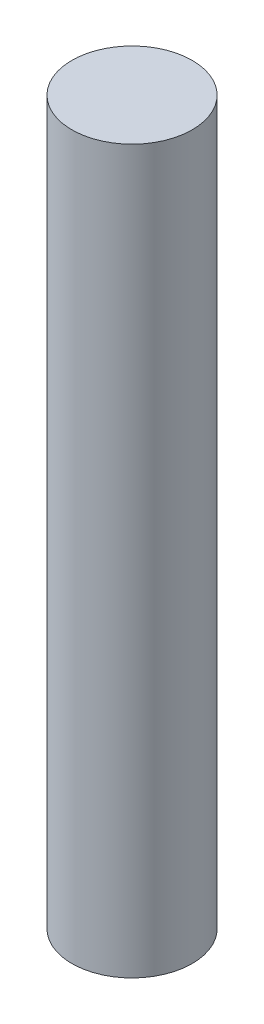
from build123d import *

# Parameters (mm, degrees)
SKETCH1_R           = 3.175
BOSS_EXTRUDE1_DEPTH = 38.1


with BuildPart() as part:
    # Sketch1 → Boss-Extrude1 (new body)
    with BuildSketch(Plane(origin=(0, 0, 0), x_dir=(1, 0, 0), z_dir=(0, 1, 0))):
        with Locations(Location((0, 0, 0), (0, 0, 90))):
            Circle(SKETCH1_R)
    extrude(amount=BOSS_EXTRUDE1_DEPTH)


solid = part.part
